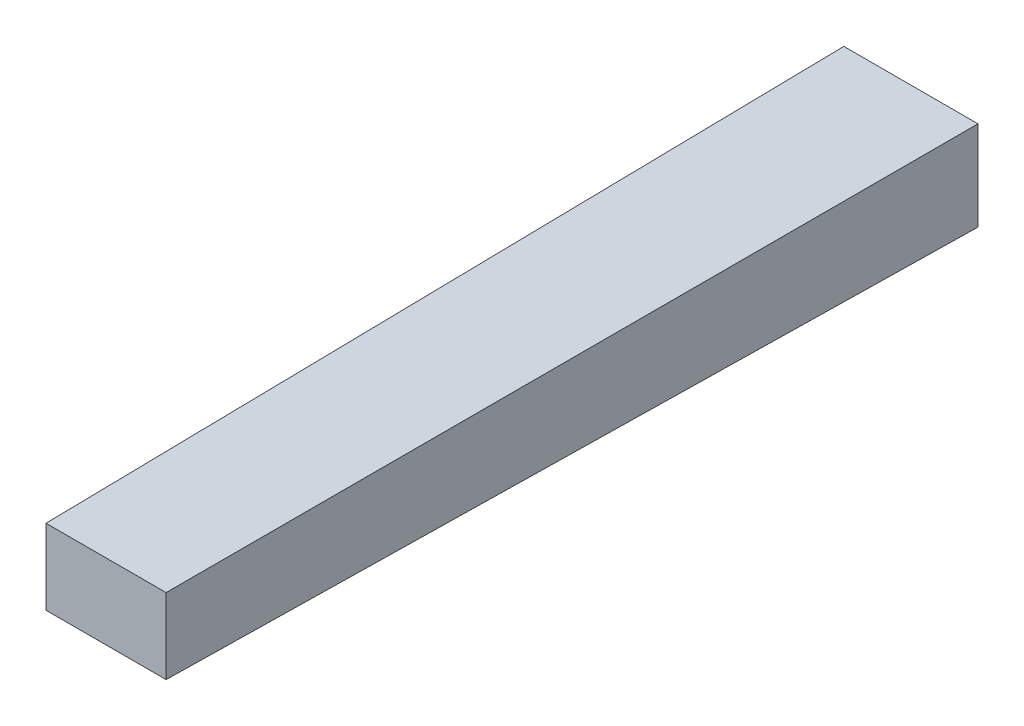
from build123d import *

# Parameters (mm, degrees)
SKETCH1_W           = 9
SKETCH1_H           = 6
BOSS_EXTRUDE1_DEPTH = 54
BOSS_EXTRUDE1_TAPER = 0.5


with BuildPart() as part:
    # Sketch1 → Boss-Extrude1 (new body)
    with BuildSketch(Plane.XY):
        with Locations((4.5, 3)):
            Rectangle(SKETCH1_W, SKETCH1_H)
    extrude(amount=BOSS_EXTRUDE1_DEPTH, taper=BOSS_EXTRUDE1_TAPER)


solid = part.part
